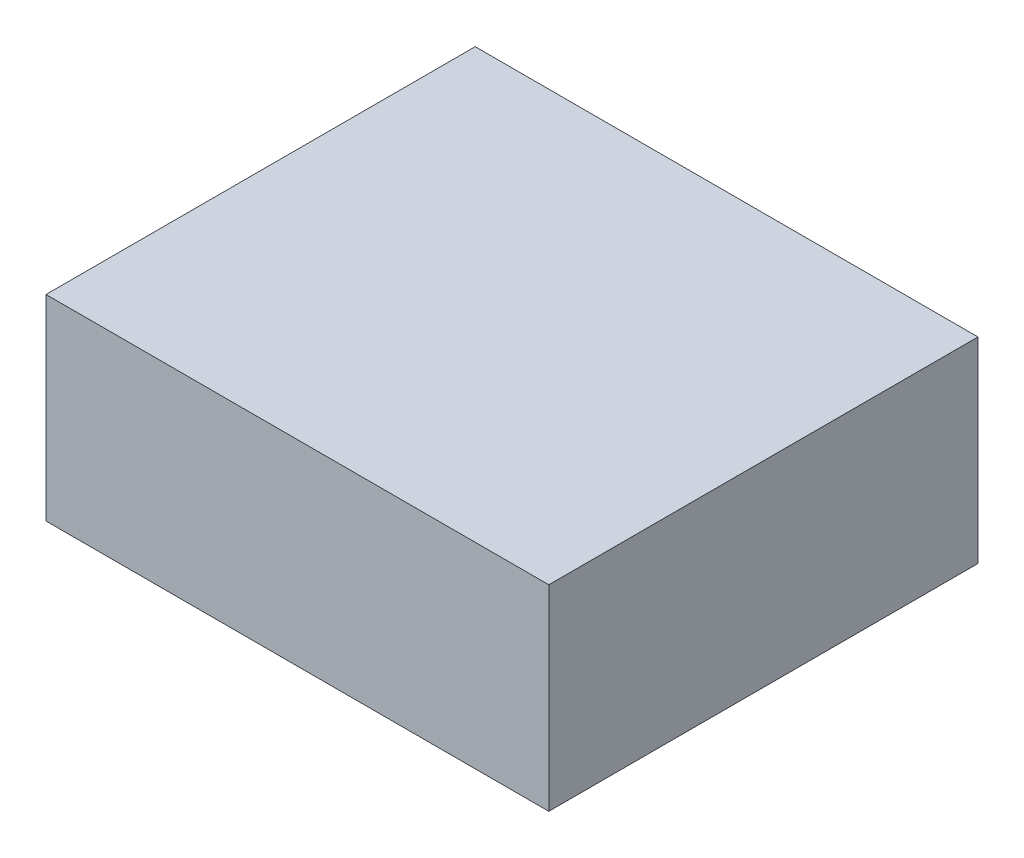
from build123d import *

# Parameters (mm, degrees)
SKETCH1_W           = 41
SKETCH1_H           = 35
BOSS_EXTRUDE1_DEPTH = 16


with BuildPart() as part:
    # Sketch1 → Boss-Extrude1 (new body)
    with BuildSketch(Plane(origin=(0, 0, 0), x_dir=(1, 0, 0), z_dir=(0, 1, 0))):
        with Locations((20.5, 17.5)):
            Rectangle(SKETCH1_W, SKETCH1_H)
    extrude(amount=BOSS_EXTRUDE1_DEPTH)


solid = part.part
